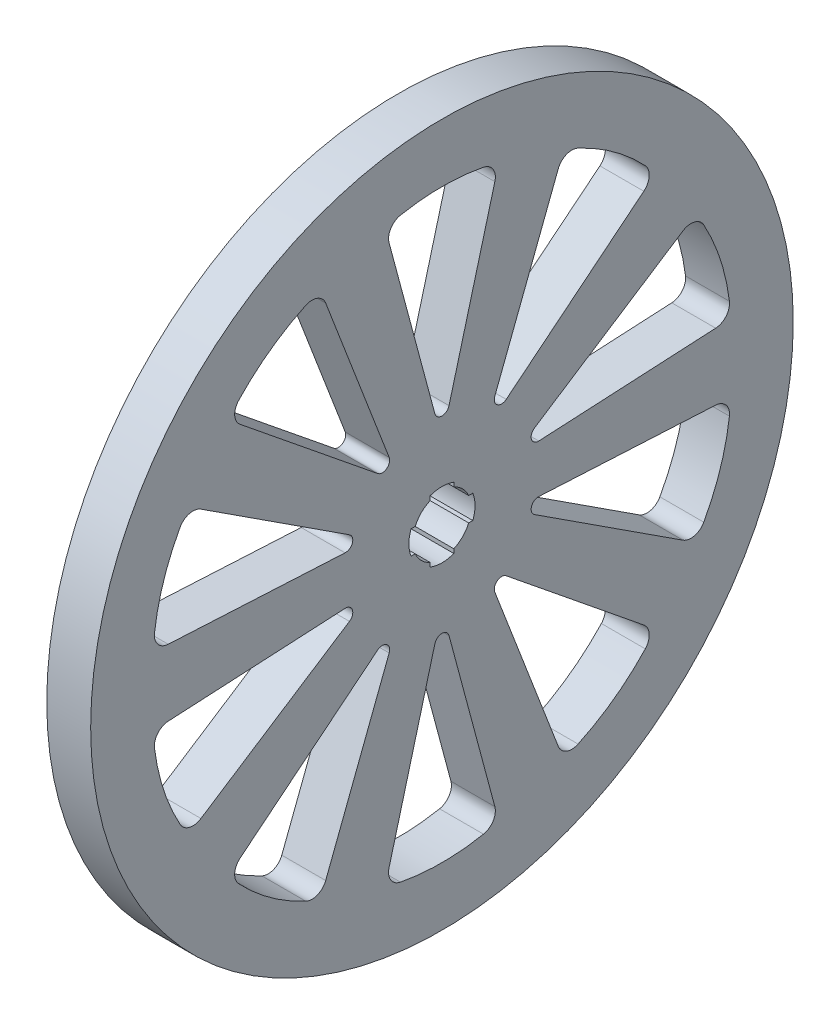
from build123d import *

# Parameters (mm, degrees)
SKETCH1_R           = 24
BOSS_EXTRUDE1_DEPTH = 3
SKETCH2_R           = 2
CUT_EXTRUDE1_DEPTH  = 3
CUT_EXTRUDE2_DEPTH  = 3
CIRPATTERN1_COUNT   = 10
CUT_EXTRUDE4_DEPTH  = 3


with BuildPart() as part:
    # Sketch1 → Boss-Extrude1 (new body)
    with BuildSketch(Plane(origin=(0, 0, 0), x_dir=(0, 0, -1), z_dir=(1, 0, 0))):
        Circle(SKETCH1_R)
    extrude(amount=BOSS_EXTRUDE1_DEPTH)

    # Sketch2 → Cut-Extrude1 (cut)
    with BuildSketch(Plane(origin=(3, 0, 0), x_dir=(0, 0, -1), z_dir=(1, 0, 0))):
        Circle(SKETCH2_R)
    extrude(amount=-CUT_EXTRUDE1_DEPTH, mode=Mode.SUBTRACT)

    # Sketch3 → Cut-Extrude2 (cut)
    with BuildSketch(Plane(origin=(3, 0, 0), x_dir=(0, 0, -1), z_dir=(1, 0, 0))):
        with BuildLine():
            Line((0.482962913, 6.80244213), (3.614211274, 18.488420103))
            ThreePointArc((3.614211274, 18.488420103), (3.495889099, 19.277869009), (2.837448694, 19.729184801))
            ThreePointArc((2.837448694, 19.729184801), (0, 20), (-2.837448694, 19.729184801))
            ThreePointArc((-2.837448694, 19.729184801), (-3.495889099, 19.277869009), (-3.614211274, 18.488420103))
            Line((-3.614211274, 18.488420103), (-0.482962913, 6.80244213))
            ThreePointArc((-0.482962913, 6.80244213), (0, 6.431851653), (0.482962913, 6.80244213))
        make_face()
    cut_extrude2 = extrude(amount=-CUT_EXTRUDE2_DEPTH, mode=Mode.SUBTRACT)

    # CirPattern1: Cut-Extrude2 ×10 about axis
    cirpattern1_axis = Axis((0, 0, 0), (1, 0, 0))
    for i in range(1, CIRPATTERN1_COUNT):
        add(cut_extrude2.rotate(cirpattern1_axis, i * 360 / CIRPATTERN1_COUNT), mode=Mode.SUBTRACT)

    # Sketch5 → Cut-Extrude4 (cut)
    with BuildSketch(Plane(origin=(3, 0, 0), x_dir=(0, 0, -1), z_dir=(1, 0, 0))):
        with BuildLine():
            Line((-2.109857815, 0.81), (-0.81, 0.81))
            Line((-0.81, 0.81), (-0.81, 2.109857815))
            add(Edge.make_bspline(
                [(-0.81, 2.109857815), (0, 2.410142185), (0.81, 2.109857815)],
                knots=[0, 0, 0, 1, 1, 1], degree=2))
            Line((0.81, 2.109857815), (0.81, 0.81))
            Line((0.81, 0.81), (2.109857815, 0.81))
            add(Edge.make_bspline(
                [(2.109857815, 0.81), (2.410142185, 0), (2.109857815, -0.81)],
                knots=[0, 0, 0, 1, 1, 1], degree=2))
            Line((2.109857815, -0.81), (0.81, -0.81))
            Line((0.81, -0.81), (0.81, -2.109857815))
            add(Edge.make_bspline(
                [(0.81, -2.109857815), (0, -2.410142185), (-0.81, -2.109857815)],
                knots=[0, 0, 0, 1, 1, 1], degree=2))
            Line((-0.81, -2.109857815), (-0.81, -0.81))
            Line((-0.81, -0.81), (-2.109857815, -0.81))
            add(Edge.make_bspline(
                [(-2.109857815, -0.81), (-2.410142185, 0), (-2.109857815, 0.81)],
                knots=[0, 0, 0, 1, 1, 1], degree=2))
        make_face()
    extrude(amount=-CUT_EXTRUDE4_DEPTH, mode=Mode.SUBTRACT)


solid = part.part
